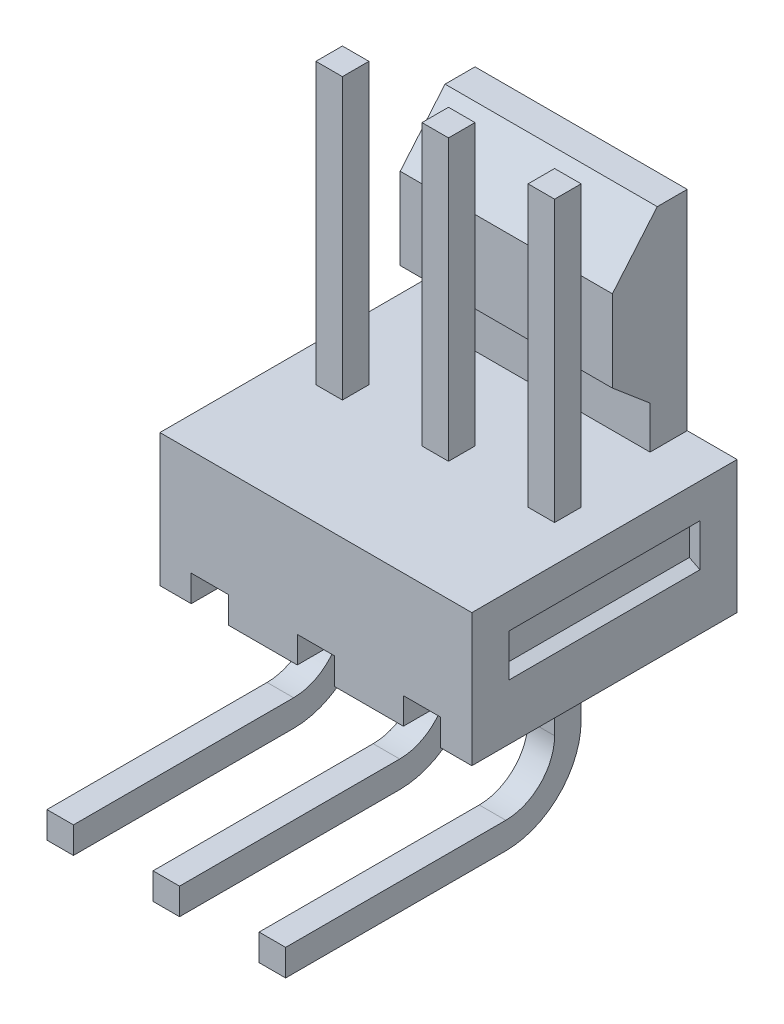
from build123d import *

# Parameters (mm, degrees)
SKETCH1_W            = 6.2738
SKETCH1_H            = 6.35
BOSS_EXTRUDE1_DEPTH  = 3.175
BOSS_EXTRUDE2_DEPTH  = 5.08
SKETCH3_W            = 6.35
SKETCH3_H            = 3.175
BOSS_EXTRUDE3_DEPTH  = 1.1938
SKETCH4_W            = 0.889
SKETCH4_H            = 0.635
CUT_EXTRUDE1_DEPTH   = 10.884786195
SKETCH5_W            = 0.635
SKETCH5_H            = 0.635
BOSS_EXTRUDE4_DEPTH  = 3.683
SKETCH6_W            = 0.635
SKETCH6_H            = 0.635
BOSS_EXTRUDE5_DEPTH  = 6.4389
SKETCH7_W            = 0.889
SKETCH7_H            = 0.635
CUT_EXTRUDE2_DEPTH   = 10.884786195
SKETCH8_W            = 0.635
SKETCH8_H            = 0.635
BOSS_EXTRUDE6_DEPTH  = 3.683
SKETCH9_W            = 0.635
SKETCH9_H            = 0.635
BOSS_EXTRUDE7_DEPTH  = 6.4389
SKETCH10_W           = 0.889
SKETCH10_H           = 0.635
CUT_EXTRUDE3_DEPTH   = 10.884786195
SKETCH11_W           = 0.635
SKETCH11_H           = 0.635
BOSS_EXTRUDE8_DEPTH  = 3.683
SKETCH12_W           = 0.635
SKETCH12_H           = 0.635
BOSS_EXTRUDE9_DEPTH  = 6.4389
SKETCH13_W           = 0.635
SKETCH13_H           = 0.635
BOSS_EXTRUDE10_DEPTH = 6.7056
SKETCH14_W           = 0.635
SKETCH14_H           = 0.635
BOSS_EXTRUDE11_DEPTH = 6.7056
SKETCH15_W           = 0.635
SKETCH15_H           = 0.635
BOSS_EXTRUDE12_DEPTH = 6.7056
CUT_EXTRUDE4_DEPTH   = 4.572
CUT_EXTRUDE5_DEPTH   = 4.572
FILLET1_R            = 1.1684
FILLET2_R            = 1.8034


with BuildPart() as part:
    # Sketch1 → Boss-Extrude1 (new body)
    with BuildSketch(Plane.XZ.offset(1.5875)):
        with Locations((-0.5969, 0)):
            Rectangle(SKETCH1_W, SKETCH1_H)
    extrude(amount=-BOSS_EXTRUDE1_DEPTH)

    # Sketch2 → Boss-Extrude2 (add)
    with BuildSketch(Plane(origin=(2.54, 0, 0), x_dir=(0, 0, -1), z_dir=(1, 0, 0))):
        Polygon((1.3843, 3.3655), (2.286, 2.6035), (2.286, 1.5875), (3.175, 1.5875), (3.175, 6.5913), (2.457539437, 6.5913), (1.3843, 5.3213), align=None)
    extrude(amount=-BOSS_EXTRUDE2_DEPTH)

    # Sketch3 → Boss-Extrude3 (add)
    with BuildSketch(Plane(origin=(2.54, 0, 0), x_dir=(0, 0, -1), z_dir=(1, 0, 0))):
        Rectangle(SKETCH3_W, SKETCH3_H)
    extrude(amount=BOSS_EXTRUDE3_DEPTH)

    # Sketch4 → Cut-Extrude1 (cut, through all)
    with BuildSketch(Plane.XY.offset(3.175)):
        with Locations((0, -1.27)):
            Rectangle(SKETCH4_W, SKETCH4_H)
    extrude(amount=-CUT_EXTRUDE1_DEPTH, mode=Mode.SUBTRACT)

    # Sketch5 → Boss-Extrude4 (add)
    with BuildSketch(Plane.XZ.offset(0.9525)):
        Rectangle(SKETCH5_W, SKETCH5_H)
    extrude(amount=BOSS_EXTRUDE4_DEPTH)

    # Sketch6 → Boss-Extrude5 (add)
    with BuildSketch(Plane.XY.offset(0.3175)):
        with Locations((0, -4.318)):
            Rectangle(SKETCH6_W, SKETCH6_H)
    extrude(amount=BOSS_EXTRUDE5_DEPTH)

    # Sketch7 → Cut-Extrude2 (cut, through all)
    with BuildSketch(Plane.XY.offset(3.175)):
        with Locations((-2.54, -1.27)):
            Rectangle(SKETCH7_W, SKETCH7_H)
    extrude(amount=-CUT_EXTRUDE2_DEPTH, mode=Mode.SUBTRACT)

    # Sketch8 → Boss-Extrude6 (add)
    with BuildSketch(Plane.XZ.offset(0.9525)):
        with Locations((-2.54, 0)):
            Rectangle(SKETCH8_W, SKETCH8_H)
    extrude(amount=BOSS_EXTRUDE6_DEPTH)

    # Sketch9 → Boss-Extrude7 (add)
    with BuildSketch(Plane.XY.offset(0.3175)):
        with Locations((-2.54, -4.318)):
            Rectangle(SKETCH9_W, SKETCH9_H)
    extrude(amount=BOSS_EXTRUDE7_DEPTH)

    # Sketch10 → Cut-Extrude3 (cut, through all)
    with BuildSketch(Plane.XY.offset(3.175)):
        with Locations((2.54, -1.27)):
            Rectangle(SKETCH10_W, SKETCH10_H)
    extrude(amount=-CUT_EXTRUDE3_DEPTH, mode=Mode.SUBTRACT)

    # Sketch11 → Boss-Extrude8 (add)
    with BuildSketch(Plane.XZ.offset(0.9525)):
        with Locations((2.54, 0)):
            Rectangle(SKETCH11_W, SKETCH11_H)
    extrude(amount=BOSS_EXTRUDE8_DEPTH)

    # Sketch12 → Boss-Extrude9 (add)
    with BuildSketch(Plane.XY.offset(0.3175)):
        with Locations((2.54, -4.318)):
            Rectangle(SKETCH12_W, SKETCH12_H)
    extrude(amount=BOSS_EXTRUDE9_DEPTH)

    # Sketch13 → Boss-Extrude10 (add)
    with BuildSketch(Plane(origin=(0, 1.5875, 0), x_dir=(-1, 0, 0), z_dir=(0, 1, 0))):
        with Locations((2.54, 0)):
            Rectangle(SKETCH13_W, SKETCH13_H)
    extrude(amount=BOSS_EXTRUDE10_DEPTH)

    # Sketch14 → Boss-Extrude11 (add)
    with BuildSketch(Plane(origin=(0, 1.5875, 0), x_dir=(-1, 0, 0), z_dir=(0, 1, 0))):
        Rectangle(SKETCH14_W, SKETCH14_H)
    extrude(amount=BOSS_EXTRUDE11_DEPTH)

    # Sketch15 → Boss-Extrude12 (add)
    with BuildSketch(Plane(origin=(0, 1.5875, 0), x_dir=(-1, 0, 0), z_dir=(0, 1, 0))):
        with Locations((-2.54, 0)):
            Rectangle(SKETCH15_W, SKETCH15_H)
    extrude(amount=BOSS_EXTRUDE12_DEPTH)

    # Sketch16 → Cut-Extrude4 (cut)
    with BuildSketch(Plane(origin=(0, 0, -2.286), x_dir=(-1, 0, 0), z_dir=(0, 0, -1))):
        Polygon((3.7338, 0.762), (3.4798, 0.635), (3.4798, -0.127), (3.7338, -0.254), align=None)
    extrude(amount=-CUT_EXTRUDE4_DEPTH, mode=Mode.SUBTRACT)

    # Sketch17 → Cut-Extrude5 (cut)
    with BuildSketch(Plane(origin=(0, 0, -2.286), x_dir=(-1, 0, 0), z_dir=(0, 0, -1))):
        Polygon((-3.7338, -0.254), (-3.4798, -0.127), (-3.4798, 0.635), (-3.7338, 0.762), align=None)
    extrude(amount=-CUT_EXTRUDE5_DEPTH, mode=Mode.SUBTRACT)

    # Fillet1
    fillet1_edges = [part.edges().sort_by_distance(p)[0] for p in [
        (-2.54, -4.0005, 0.3175),
        (2.54, -4.0005, 0.3175),
        (0, -4.0005, 0.3175),
    ]]
    fillet(fillet1_edges, radius=FILLET1_R)

    # Fillet2
    fillet2_edges = [part.edges().sort_by_distance(p)[0] for p in [
        (-2.54, -4.6355, -0.3175),
        (2.54, -4.6355, -0.3175),
        (0, -4.6355, -0.3175),
    ]]
    fillet(fillet2_edges, radius=FILLET2_R)


solid = part.part
